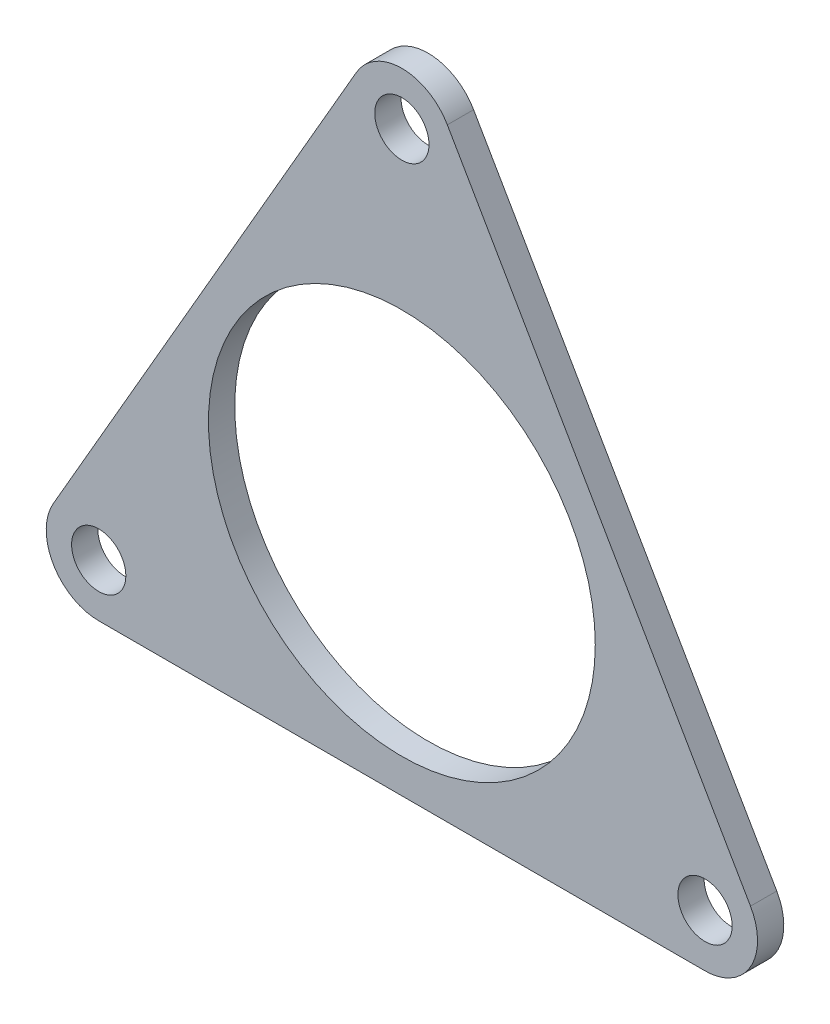
from build123d import *

# Parameters (mm, degrees)
SKETCH_1_R          = 1.55
EXTRUDE_1_DEPTH     = 1.5
SKETCH_2_R          = 11.05
CUT_EXTRUDE_1_DEPTH = 1.5


with BuildPart() as part:
    # 草图1 → 凸台-拉伸1 (new body)
    with BuildSketch(Plane.XY):
        with BuildLine():
            Line((-2.598076211, 21.5), (-19.918584287, -8.5))
            ThreePointArc((-19.918584287, -8.5), (-19.918584287, -11.5), (-17.320508076, -13))
            Line((-17.320508076, -13), (17.320508076, -13))
            ThreePointArc((17.320508076, -13), (19.918584287, -11.5), (19.918584287, -8.5))
            Line((19.918584287, -8.5), (2.598076211, 21.5))
            ThreePointArc((2.598076211, 21.5), (0, 23), (-2.598076211, 21.5))
        make_face()
        with Locations((0, 20)):
            Circle(SKETCH_1_R, mode=Mode.SUBTRACT)
        with Locations((-17.320508076, -10)):
            Circle(SKETCH_1_R, mode=Mode.SUBTRACT)
        with Locations((17.320508076, -10)):
            Circle(SKETCH_1_R, mode=Mode.SUBTRACT)
    extrude(amount=EXTRUDE_1_DEPTH)

    # 草图2 → 切除-拉伸1 (cut)
    with BuildSketch(Plane.XY.offset(1.5)):
        Circle(SKETCH_2_R)
    extrude(amount=-CUT_EXTRUDE_1_DEPTH, mode=Mode.SUBTRACT)


solid = part.part
